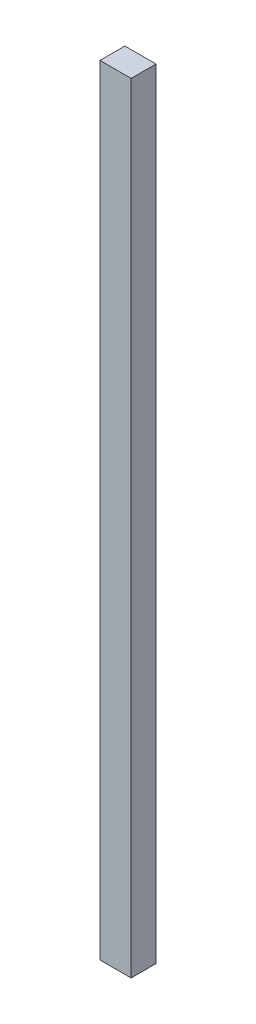
from build123d import *

# Parameters (mm, degrees)
SKETCH1_W           = 50
SKETCH1_H           = 1250
BOSS_EXTRUDE1_DEPTH = 40


with BuildPart() as part:
    # Sketch1 → Boss-Extrude1 (new body)
    with BuildSketch(Plane.XY):
        with Locations((1805, -825)):
            Rectangle(SKETCH1_W, SKETCH1_H)
    extrude(amount=BOSS_EXTRUDE1_DEPTH)


solid = part.part
